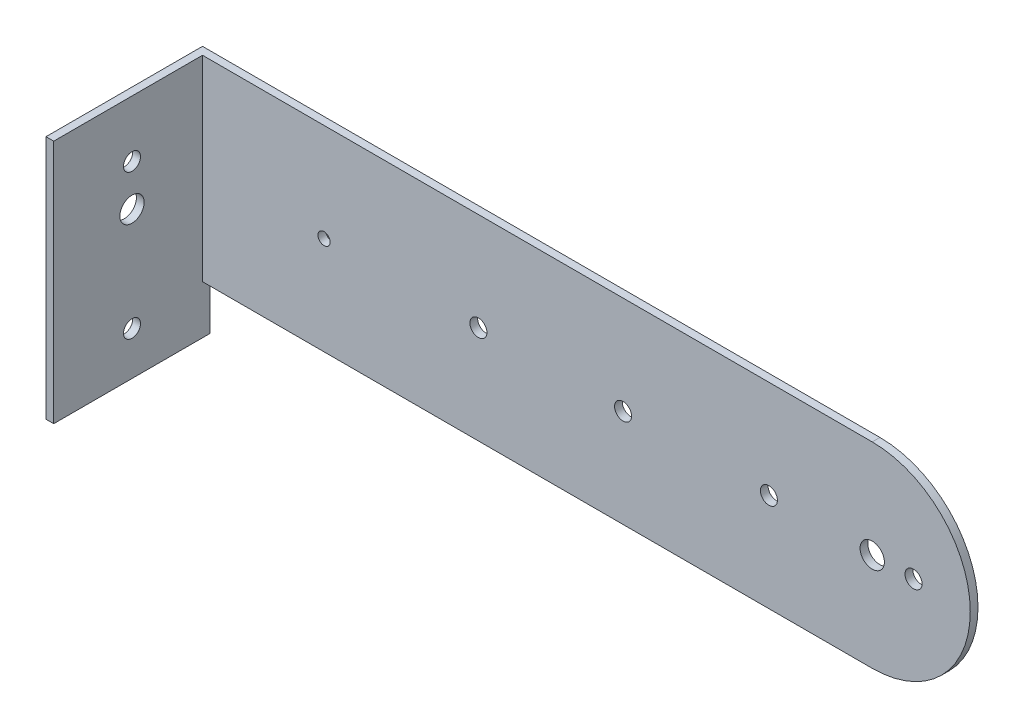
from build123d import *

# Parameters (mm, degrees)
BOSS_EXTRUDE1_DEPTH = 1.59
SKETCH2_R           = 2.5
SKETCH2_R_2         = 1.75
CUT_EXTRUDE2_DEPTH  = 1.59
SKETCH3_W           = 1.59
SKETCH3_H           = 40.336400608
BOSS_EXTRUDE2_DEPTH = 30.602
SKETCH5_R           = 2.5
SKETCH5_R_2         = 1.75
CUT_EXTRUDE4_DEPTH  = 10
SKETCH6_W           = 32.192
SKETCH6_H           = 10
BOSS_EXTRUDE3_DEPTH = 1.59
SKETCH7_R           = 1.75
CUT_EXTRUDE5_DEPTH  = 10
SKETCH8_R           = 1.25
CUT_EXTRUDE6_DEPTH  = 10


with BuildPart() as part:
    # Sketch1 → Boss-Extrude1 (new body)
    with BuildSketch(Plane.XY):
        with BuildLine():
            Line((-39.610035237, 20.168200304), (39.610035237, 20.168200304))
            ThreePointArc((39.610035237, 20.168200304), (59.77823554, 0), (39.610035237, -20.168200304))
            Line((39.610035237, -20.168200304), (-39.610035237, -20.168200304))
            Line((-39.610035237, -20.168200304), (-99.729964763, -20.168200304))
            Line((-99.729964763, -20.168200304), (-99.729964763, 20.168200304))
            Line((-99.729964763, 20.168200304), (-39.610035237, 20.168200304))
        make_face()
    extrude(amount=BOSS_EXTRUDE1_DEPTH)

    # Sketch2 → Cut-Extrude2 (cut)
    with BuildSketch(Plane.XY.offset(1.59)):
        with Locations((39.610035237, 0)):
            Circle(SKETCH2_R)
        with Locations((48.110035237, 0)):
            Circle(SKETCH2_R_2)
        with Locations((18.360035237, 0)):
            Circle(SKETCH2_R_2)
        with Locations((-11.639964763, 0)):
            Circle(SKETCH2_R_2)
        with Locations((-41.389964763, 0)):
            Circle(SKETCH2_R_2)
    extrude(amount=-CUT_EXTRUDE2_DEPTH, mode=Mode.SUBTRACT)

    # Sketch3 → Boss-Extrude2 (add)
    with BuildSketch(Plane.XY.offset(1.59)):
        with Locations((-98.934964763, 0)):
            Rectangle(SKETCH3_W, SKETCH3_H)
    extrude(amount=BOSS_EXTRUDE2_DEPTH)

    # Sketch5 → Cut-Extrude4 (cut)
    with BuildSketch(Plane.ZY.offset(99.729964763)):
        with Locations((16.096, 0)):
            Circle(SKETCH5_R)
        with Locations((16.096, 8.5)):
            Circle(SKETCH5_R_2)
        with Locations((16.096, -21.25)):
            Circle(SKETCH5_R_2)
    extrude(amount=-CUT_EXTRUDE4_DEPTH, mode=Mode.SUBTRACT)

    # Sketch6 → Boss-Extrude3 (add)
    with BuildSketch(Plane.ZY.offset(99.729964763)):
        with Locations((16.096, -25.168200304)):
            Rectangle(SKETCH6_W, SKETCH6_H)
    extrude(amount=-BOSS_EXTRUDE3_DEPTH)

    # Sketch7 → Cut-Extrude5 (cut)
    with BuildSketch(Plane.ZY.offset(99.729964763)):
        with Locations((16.096, -21.25)):
            Circle(SKETCH7_R)
    extrude(amount=-CUT_EXTRUDE5_DEPTH, mode=Mode.SUBTRACT)

    # Sketch8 → Cut-Extrude6 (cut)
    with BuildSketch(Plane.XY.offset(1.59)):
        with Locations((-73.139964763, 0)):
            Circle(SKETCH8_R)
    extrude(amount=-CUT_EXTRUDE6_DEPTH, mode=Mode.SUBTRACT)


solid = part.part
